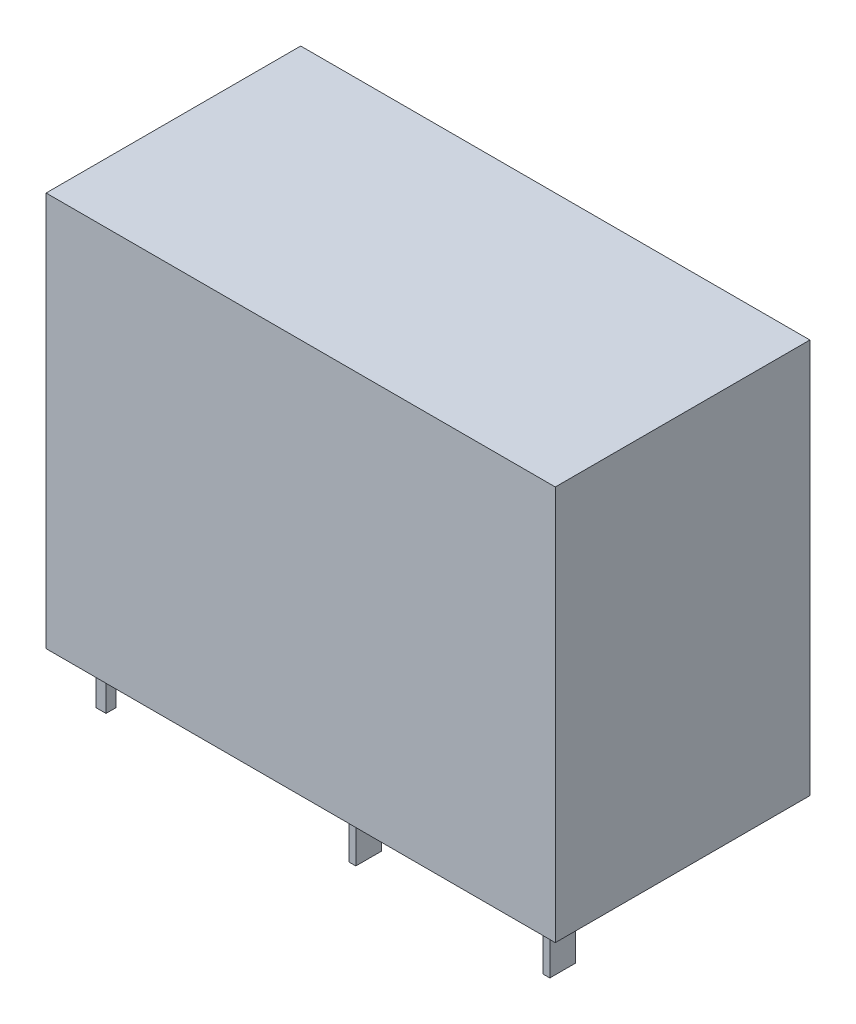
from build123d import *

# Parameters (mm, degrees)
SKETCH_1_W        = 20
SKETCH_1_H        = 10
EXTRUDE_1_DEPTH   = 15.5
SKETCH_2_W        = 0.4
SKETCH_2_H        = 0.4
EXTRUDE_2_DEPTH   = 2
EXTRUDE_2_2_DEPTH = 2
SKETCH_2_W_2      = 0.27
SKETCH_2_H_2      = 1
EXTRUDE_2_3_DEPTH = 2
EXTRUDE_2_4_DEPTH = 2
EXTRUDE_2_5_DEPTH = 2


with BuildPart() as part:
    # Эскиз1 → Бобышка-Вытянуть1 (new body)
    with BuildSketch(Plane(origin=(0, 0, 0), x_dir=(1, 0, 0), z_dir=(0, 1, 0))):
        Rectangle(SKETCH_1_W, SKETCH_1_H)
    extrude(amount=EXTRUDE_1_DEPTH)


with BuildPart() as body_2:
    # Эскиз2 → Бобышка-Вытянуть2 (new body)
    with BuildSketch(Plane(origin=(0, 0, 0), x_dir=(1, 0, 0), z_dir=(0, 1, 0))):
        with Locations((-8.82, 3.81)):
            Rectangle(SKETCH_2_W, SKETCH_2_H)
    extrude(amount=-EXTRUDE_2_DEPTH)


with BuildPart() as body_3:
    # Эскиз2 → Extrude 2 2 (new body)
    with BuildSketch(Plane(origin=(0, 0, 0), x_dir=(1, 0, 0), z_dir=(0, 1, 0))):
        with Locations((-8.82, -3.828134121)):
            Rectangle(SKETCH_2_W, SKETCH_2_H)
    extrude(amount=-EXTRUDE_2_2_DEPTH)


with BuildPart() as body_4:
    # Эскиз2 → Extrude 2 3 (new body)
    with BuildSketch(Plane(origin=(0, 0, 0), x_dir=(1, 0, 0), z_dir=(0, 1, 0))):
        with Locations((1.34, -3.81)):
            Rectangle(SKETCH_2_W_2, SKETCH_2_H_2)
    extrude(amount=-EXTRUDE_2_3_DEPTH)


with BuildPart() as body_5:
    # Эскиз2 → Extrude 2 4 (new body)
    with BuildSketch(Plane(origin=(0, 0, 0), x_dir=(1, 0, 0), z_dir=(0, 1, 0))):
        with Locations((8.96, -3.81)):
            Rectangle(SKETCH_2_W_2, SKETCH_2_H_2)
    extrude(amount=-EXTRUDE_2_4_DEPTH)


with BuildPart() as body_6:
    # Эскиз2 → Extrude 2 5 (new body)
    with BuildSketch(Plane(origin=(0, 0, 0), x_dir=(1, 0, 0), z_dir=(0, 1, 0))):
        with Locations((6.42, 3.81)):
            Rectangle(SKETCH_2_W_2, SKETCH_2_H_2)
    extrude(amount=-EXTRUDE_2_5_DEPTH)


solid = Compound([part.part, body_2.part, body_3.part, body_4.part, body_5.part, body_6.part])
